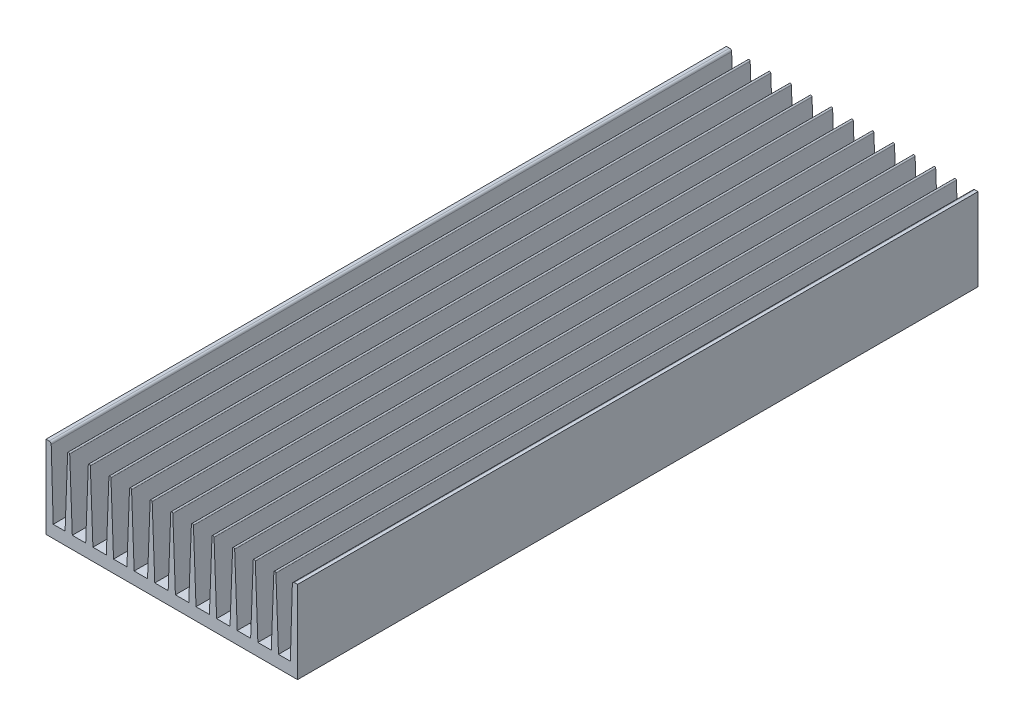
from build123d import *

# Parameters (mm, degrees)
EXTRUDE_1_DEPTH       = 330
EXTRUDE_3_DEPTH       = 330
PATTERN_CURVE_1_COUNT = 11
PATTERN_CURVE_1_PITCH = 10
SKETCH_3_R            = 2.25
CUT_EXTRUDE_1_DEPTH   = 6
SKETCH_4_R            = 1.6
CUT_EXTRUDE_2_DEPTH   = 6


with BuildPart() as part:
    # Эскиз1 → Вытянуть1 (new body)
    with BuildSketch(Plane.XY):
        with BuildLine():
            Line((0, 40), (1.528979332, 40))
            ThreePointArc((1.528979332, 40), (2.225614441, 39.717425624), (2.528547087, 39.029399052))
            Line((2.528547087, 39.029399052), (3.5, 6))
            Line((3.5, 6), (118.5, 6))
            Line((118.5, 6), (119.471452913, 39.029399052))
            ThreePointArc((119.471452913, 39.029399052), (119.774385559, 39.717425624), (120.471020668, 40))
            Line((120.471020668, 40), (122, 40))
            Line((122, 40), (122, 0))
            Line((122, 0), (0, 0))
            Line((0, 0), (0, 40))
        make_face()
    extrude(amount=EXTRUDE_1_DEPTH)

    # Эскиз2 → Вытянуть3 (add)
    with BuildSketch(Plane.XY.offset(330)):
        with BuildLine():
            Line((10.5, 39.5), (9.25, 6))
            Line((9.25, 6), (12.75, 6))
            Line((12.75, 6), (11.5, 39.5))
            ThreePointArc((11.5, 39.5), (11, 40), (10.5, 39.5))
        make_face()
    extrude_3 = extrude(amount=-EXTRUDE_3_DEPTH)

    # Кривая1: Вытянуть3 ×11
    with Locations(*[(i * PATTERN_CURVE_1_PITCH, 0, 0) for i in range(1, PATTERN_CURVE_1_COUNT)]):
        add(extrude_3)

    # Эскиз3 → Вырез-Вытянуть1 (cut)
    with BuildSketch(Plane.XZ):
        with Locations((28, 322)):
            Circle(SKETCH_3_R)
        with Locations((94, 322)):
            Circle(SKETCH_3_R)
        with Locations(Location((94, 8, 0), (0, 0, 236.251011404))):
            Circle(SKETCH_3_R)
        with Locations(Location((28, 8, 0), (0, 0, 56.251011404))):
            Circle(SKETCH_3_R)
    extrude(amount=-CUT_EXTRUDE_1_DEPTH, mode=Mode.SUBTRACT)

    # Эскиз4 → Вырез-Вытянуть2 (cut)
    with BuildSketch(Plane(origin=(147.933613103, 0, 237.946321054), x_dir=(-1, 0, 0), z_dir=(0, -1, 0))):
        with Locations(Location((94.933613103, -51.053678946, 0), (0, 0, 180))):
            Circle(SKETCH_4_R)
        with Locations(Location((116.933613103, 111.946321054, 0), (0, 0, 180))):
            Circle(SKETCH_4_R)
        with Locations(Location((68.933613103, 211.946321054, 0), (0, 0, 180))):
            Circle(SKETCH_4_R)
        with Locations(Location((68.933613103, 91.946321054, 0), (0, 0, 180))):
            Circle(SKETCH_4_R)
        with Locations(Location((81.933613103, 111.946321054, 0), (0, 0, 180))):
            Circle(SKETCH_4_R)
        with Locations(Location((116.933613103, 171.946321054, 0), (0, 0, 180))):
            Circle(SKETCH_4_R)
        with Locations(Location((81.933613103, 171.946321054, 0), (0, 0, 180))):
            Circle(SKETCH_4_R)
        with Locations(Location((94.933613103, 58.946321054, 0), (0, 0, 180))):
            Circle(SKETCH_4_R)
        with Locations(Location((55.933613103, -65.553678946, 0), (0, 0, 180))):
            Circle(SKETCH_4_R)
        with Locations(Location((67.933613103, 72.446321054, 0), (0, 0, 180))):
            Circle(SKETCH_4_R)
    extrude(amount=-CUT_EXTRUDE_2_DEPTH, mode=Mode.SUBTRACT)


solid = part.part
